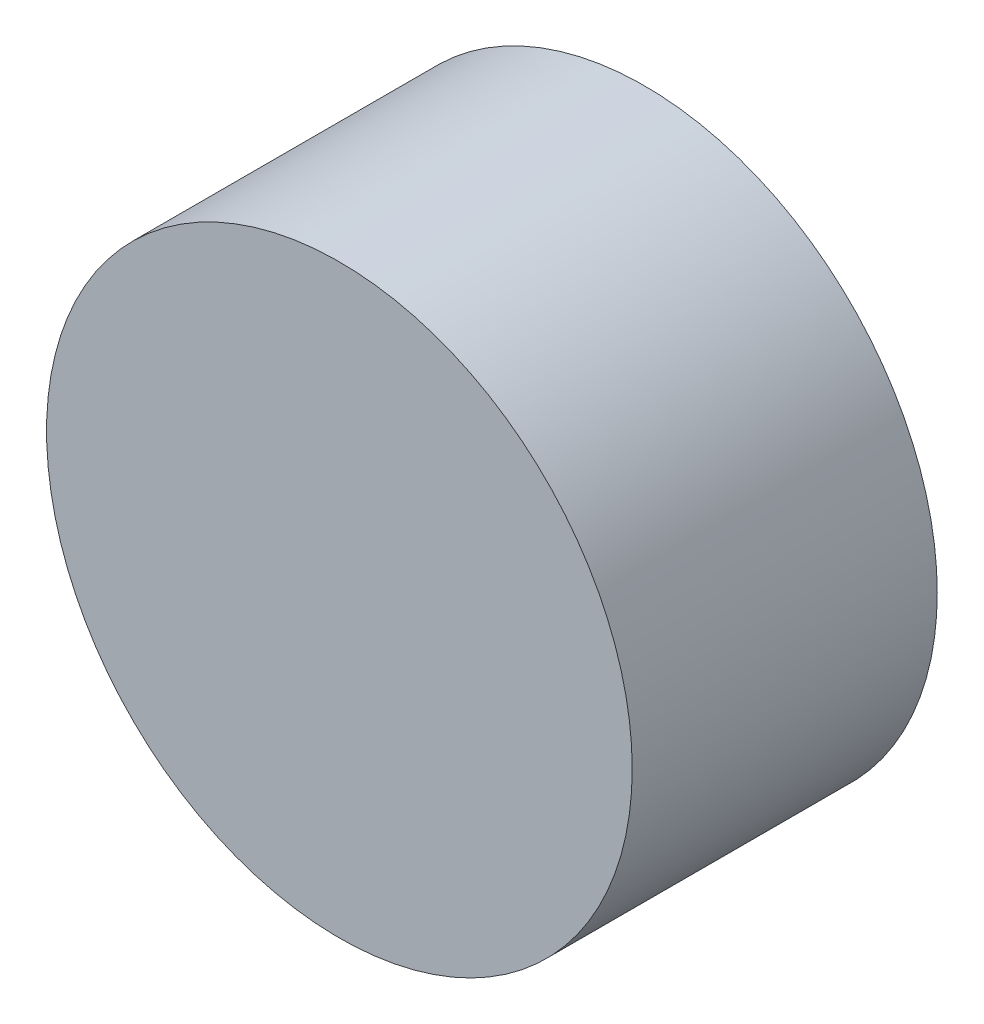
from build123d import *

# Parameters (mm, degrees)
SKETCH_1_R      = 24
EXTRUDE_1_DEPTH = 25


with BuildPart() as part:
    # ｽｹｯﾁ1 → ﾎﾞｽ - 押し出し1 (new body)
    with BuildSketch(Plane.XY):
        Circle(SKETCH_1_R)
    extrude(amount=EXTRUDE_1_DEPTH)


solid = part.part
